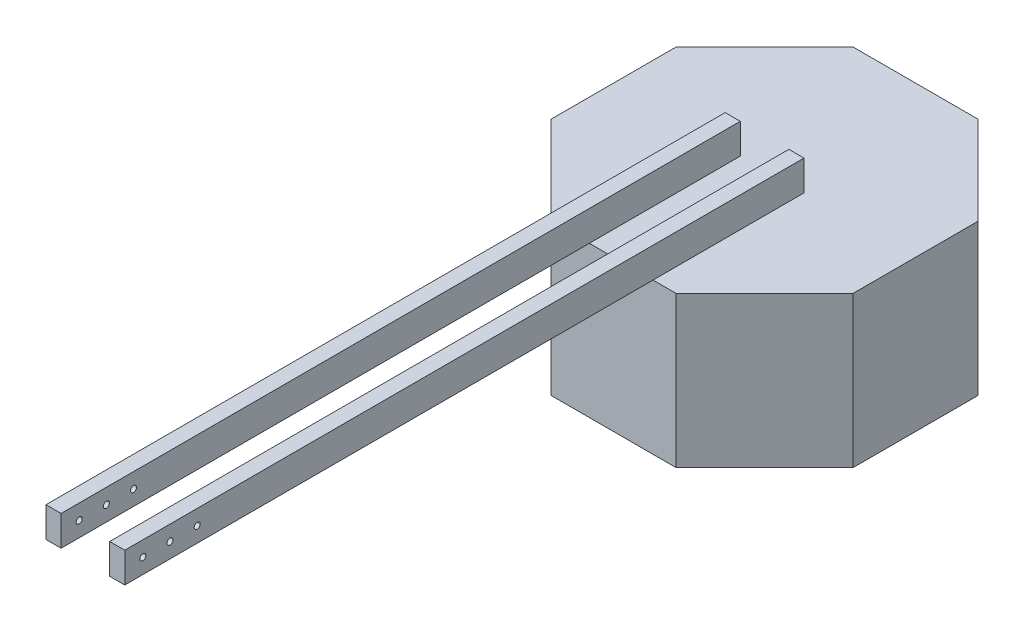
from build123d import *

# Parameters (mm, degrees)
BOSS_EXTRUDE1_DEPTH = 100
SKETCH2_W           = 10
SKETCH2_H           = 450
BOSS_EXTRUDE2_DEPTH = 20
SKETCH3_R           = 2
CUT_EXTRUDE1_DEPTH  = 483.494777174


with BuildPart() as part:
    # Sketch1 → Boss-Extrude1 (new body)
    with BuildSketch(Plane(origin=(0, 0, 0), x_dir=(1, 0, 0), z_dir=(0, 1, 0))):
        Polygon((100, -41.421356237), (100, 41.421356237), (41.421356237, 100), (-41.421356237, 100), (-100, 41.421356237), (-100, -41.421356237), (-41.421356237, -100), (41.421356237, -100), align=None)
    extrude(amount=BOSS_EXTRUDE1_DEPTH)

    # Sketch2 → Boss-Extrude2 (add)
    with BuildSketch(Plane(origin=(0, 100, 0), x_dir=(1, 0, 0), z_dir=(0, 1, 0))):
        with Locations((-21.1, -225)):
            Rectangle(SKETCH2_W, SKETCH2_H)
        with Locations((21.1, -225)):
            Rectangle(SKETCH2_W, SKETCH2_H)
    extrude(amount=BOSS_EXTRUDE2_DEPTH)

    # Sketch3 → Cut-Extrude1 (cut, through all)
    with BuildSketch(Plane.ZY.offset(26.1)):
        with Locations((438, 110)):
            Circle(SKETCH3_R)
        with Locations((420, 110)):
            Circle(SKETCH3_R)
        with Locations((402, 110)):
            Circle(SKETCH3_R)
    extrude(amount=-CUT_EXTRUDE1_DEPTH, mode=Mode.SUBTRACT)


solid = part.part
